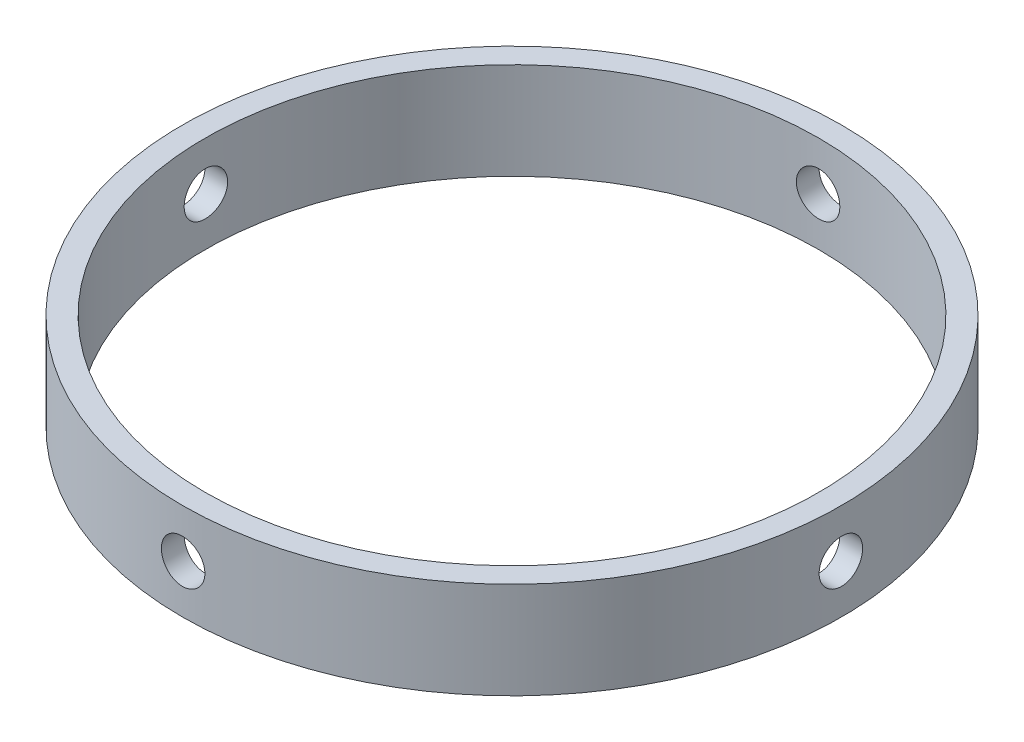
from build123d import *

# Parameters (mm, degrees)
SKETCH1_R           = 34.1
SKETCH1_R_2         = 31.75
BOSS_EXTRUDE1_DEPTH = 5
SKETCH2_R           = 2.25
CUT_EXTRUDE1_DEPTH  = 49.483192964
CIRPATTERN1_COUNT   = 4


with BuildPart() as part:
    # Sketch1 → Boss-Extrude1 (new, symmetric)
    with BuildSketch(Plane(origin=(0, 0, 0), x_dir=(1, 0, 0), z_dir=(0, 1, 0))):
        with Locations(Location((0, 0, 0), (0, 0, 270))):
            Circle(SKETCH1_R)
        with Locations(Location((0, 0, 0), (0, 0, 270))):
            Circle(SKETCH1_R_2, mode=Mode.SUBTRACT)
    extrude(amount=BOSS_EXTRUDE1_DEPTH, both=True)

    # Sketch2 → Cut-Extrude1 (cut, through all)
    with BuildSketch(Plane.XY):
        with Locations(Location((0, 0, 0), (0, 0, 90))):
            Circle(SKETCH2_R)
    cut_extrude1 = extrude(amount=-CUT_EXTRUDE1_DEPTH, mode=Mode.SUBTRACT)

    # CirPattern1: Cut-Extrude1 ×4 about axis
    cirpattern1_axis = Axis((0, 5, 0), (0, -1, 0))
    for i in range(1, CIRPATTERN1_COUNT):
        add(cut_extrude1.rotate(cirpattern1_axis, i * 360 / CIRPATTERN1_COUNT), mode=Mode.SUBTRACT)


solid = part.part
